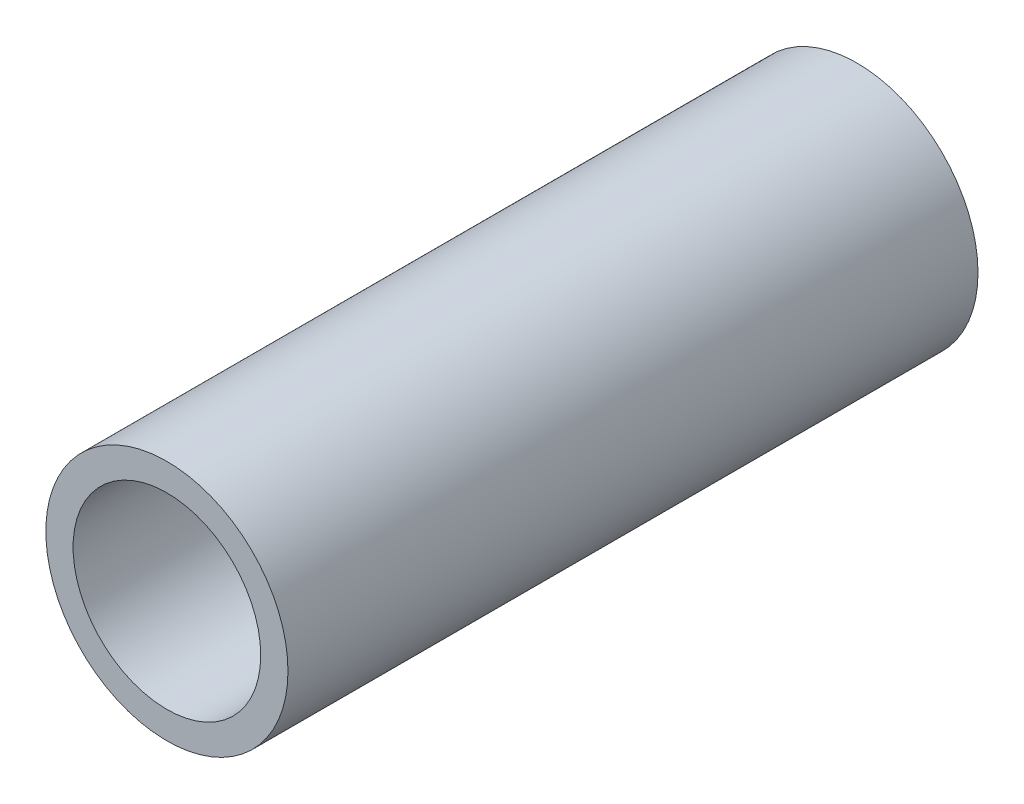
from build123d import *

# Parameters (mm, degrees)
SKETCH_1_R      = 1
SKETCH_1_R_2    = 0.775
EXTRUDE_1_DEPTH = 5.7


with BuildPart() as part:
    # Эскиз1 → Бобышка-Вытянуть1 (new body)
    with BuildSketch(Plane.XY):
        Circle(SKETCH_1_R)
        Circle(SKETCH_1_R_2, mode=Mode.SUBTRACT)
    extrude(amount=EXTRUDE_1_DEPTH)


solid = part.part
